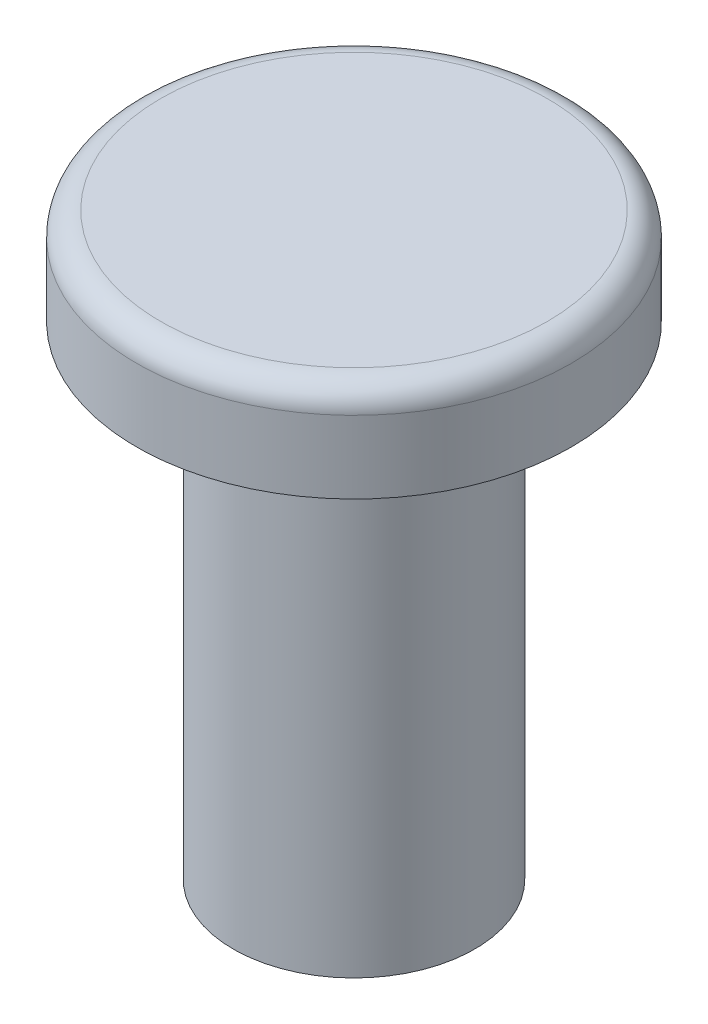
from build123d import *

# Parameters (mm, degrees)
FILLET1_R = 0.25


with BuildPart() as part:
    # Sketch1 → Revolve1 (revolve)
    with BuildSketch(Plane.XY):
        Polygon((0, 5.801980198), (0, -0.198019802), (-1.25, -0.198019802), (-1.25, 4.801980198), (-2.25, 4.801980198), (-2.25, 5.801980198), align=None)
    revolve(axis=Axis((0, 5.801980198, 0), (0, -1, 0)))

    # Fillet1
    fillet1_edges = [part.edges().sort_by_distance(p)[0] for p in [
        (2.25, 5.801980198, 0),
    ]]
    fillet(fillet1_edges, radius=FILLET1_R)


solid = part.part
